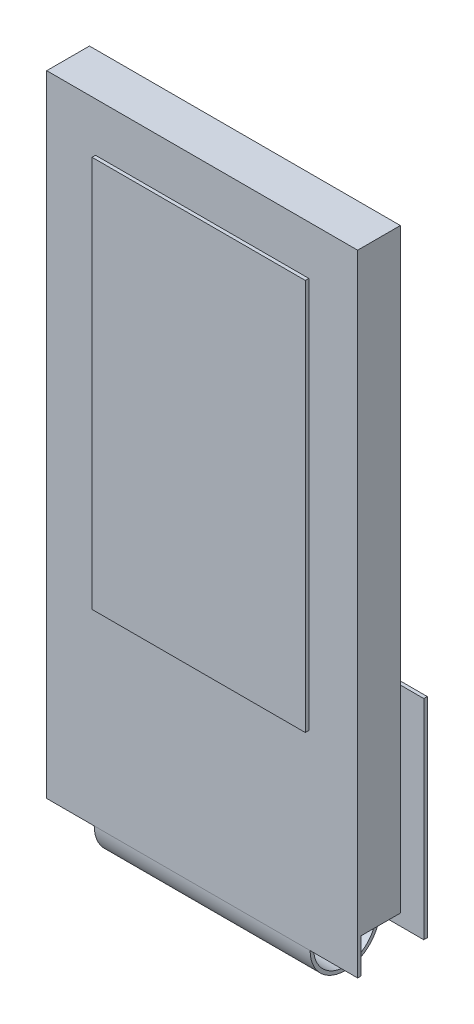
from build123d import *

# Parameters (mm, degrees)
ESQUISSE1_W             = 8.928
ESQUISSE1_H             = 17.1
BOSS_EXTRU_1_DEPTH      = 1.227
ESQUISSE2_W             = 6.124
ESQUISSE2_H             = 11.244
BOSS_EXTRU_2_DEPTH      = 0.1
BOSS_EXTRU_4_DEPTH      = 8.928
ENL_V_MAT_EXTRU_1_REACH = 13.629
ESQUISSE5_W             = 1.364
ESQUISSE5_H             = 1


with BuildPart() as part:
    # Esquisse1 → Boss.-Extru.1 (new body)
    with BuildSketch(Plane.XY):
        Rectangle(ESQUISSE1_W, ESQUISSE1_H)
    extrude(amount=BOSS_EXTRU_1_DEPTH)

    # Esquisse2 → Boss.-Extru.2 (add)
    with BuildSketch(Plane.XY.offset(1.227)):
        with Locations((0, 1.525)):
            Rectangle(ESQUISSE2_W, ESQUISSE2_H)
    extrude(amount=BOSS_EXTRU_2_DEPTH)

    # Esquisse4 → Boss.-Extru.4 (add)
    with BuildSketch(Plane(origin=(4.464, 0, 0), x_dir=(0, 0, -1), z_dir=(1, 0, 0))):
        with BuildLine():
            Line((-1.227, -8.55), (-1.227, -9.55))
            ThreePointArc((-1.227, -9.55), (-0.227, -10.55), (0.773, -9.55))
            Line((0.773, -9.55), (0.773, -3.55))
            Line((0.773, -3.55), (0.673, -3.55))
            Line((0.673, -3.55), (0.673, -9.55))
            ThreePointArc((0.673, -9.55), (-0.227, -10.45), (-1.127, -9.55))
            Line((-1.127, -9.55), (-1.127, -8.55))
            Line((-1.127, -8.55), (-1.227, -8.55))
        make_face()
    extrude(amount=-BOSS_EXTRU_4_DEPTH)

    # Esquisse5 → Enlèv. mat.-Extru.1 (cut, up to next)
    with BuildSketch(Plane.XY.offset(1.227), mode=Mode.PRIVATE) as enl_v_mat_extru_1_sk1:
        with Locations((3.782, -10.05)):
            Rectangle(ESQUISSE5_W, ESQUISSE5_H)
    enl_v_mat_extru_1_tool1 = extrude(enl_v_mat_extru_1_sk1.sketch, amount=-ENL_V_MAT_EXTRU_1_REACH, mode=Mode.PRIVATE) & part.part
    # Esquisse5 → Enlèv. mat.-Extru.1 (cut, up to next)
    with BuildSketch(Plane.XY.offset(1.227), mode=Mode.PRIVATE) as enl_v_mat_extru_1_sk2:
        with Locations((-3.782, -10.05)):
            Rectangle(ESQUISSE5_W, ESQUISSE5_H)
    enl_v_mat_extru_1_tool2 = extrude(enl_v_mat_extru_1_sk2.sketch, amount=-ENL_V_MAT_EXTRU_1_REACH, mode=Mode.PRIVATE) & part.part
    add(enl_v_mat_extru_1_tool1.solids().sort_by_distance((3.782, -10.05, 1.227))[0], mode=Mode.SUBTRACT)
    add(enl_v_mat_extru_1_tool2.solids().sort_by_distance((-3.782, -10.05, 1.227))[0], mode=Mode.SUBTRACT)


solid = part.part
